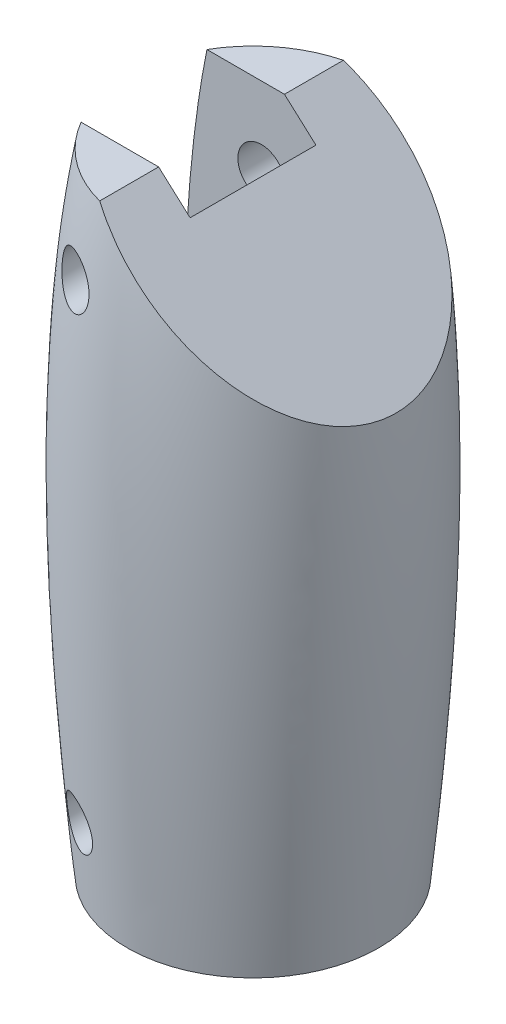
from build123d import *

# Parameters (mm, degrees)
SKETCH2_W               = 8
SKETCH2_H               = 13
SKETCH2_H_2             = 10
CUT_EXTRUDE1_DEPTH      = 24.938835821
CUT_EXTRUDE2_DEPTH      = 24.938835821
CUT_EXTRUDE2_DEPTH_BACK = 24.938835821
SKETCH3_R               = 1.5
CUT_EXTRUDE3_DEPTH      = 10
CUT_EXTRUDE3_DEPTH_BACK = 10


with BuildPart() as part:
    # Sketch1 → Revolve1 (revolve)
    with BuildSketch(Plane(origin=(0, 0, 0), x_dir=(0, 0, -1), z_dir=(1, 0, 0))):
        with BuildLine():
            Line((0, 20), (0, -20))
            Line((0, -20), (8, -20))
            add(Edge.make_bspline(
                [(8, 20), (10.604722665, 5.227883705), (8, -20)],
                knots=[0, 0, 0, 1, 1, 1], degree=2))
            Line((8, 20), (0, 20))
        make_face()
    revolve(axis=Axis((0, 20, 0), (0, -1, 0)))

    # Sketch2 → Cut-Extrude1 (cut, through all)
    with BuildSketch(Plane(origin=(0, 0, 0), x_dir=(0, 0, -1), z_dir=(1, 0, 0))):
        with Locations((0, 13.5)):
            Rectangle(SKETCH2_W, SKETCH2_H)
        with Locations((0, -15)):
            Rectangle(SKETCH2_W, SKETCH2_H_2)
    extrude(amount=-CUT_EXTRUDE1_DEPTH, mode=Mode.SUBTRACT)

    # Sketch3 → Cut-Extrude2 (cut, two sides: drawn at the far end of the back side and taken through both)
    with BuildSketch(Plane.XY.offset(-CUT_EXTRUDE2_DEPTH_BACK)):
        with Locations((-3.464101615, 15)):
            Circle(SKETCH3_R)
        with Locations((-3.464101615, -15)):
            Circle(SKETCH3_R)
    extrude(amount=CUT_EXTRUDE2_DEPTH + CUT_EXTRUDE2_DEPTH_BACK, mode=Mode.SUBTRACT)

    # Sketch4 → Cut-Extrude3 (cut, two sides: drawn at the far end of the back side and taken through both)
    with BuildSketch(Plane.XY.offset(-CUT_EXTRUDE3_DEPTH_BACK)):
        with BuildLine():
            Line((-2, 20), (9.10519633, 10))
            add(Edge.make_bspline(
                [(9.10519633, 10), (8.795626613, 15.487777253), (8, 20)],
                knots=[0.694544596, 0.694544596, 0.694544596, 1, 1, 1], degree=2))
            Line((8, 20), (-2, 20))
        make_face()
    extrude(amount=CUT_EXTRUDE3_DEPTH + CUT_EXTRUDE3_DEPTH_BACK, mode=Mode.SUBTRACT)


solid = part.part
